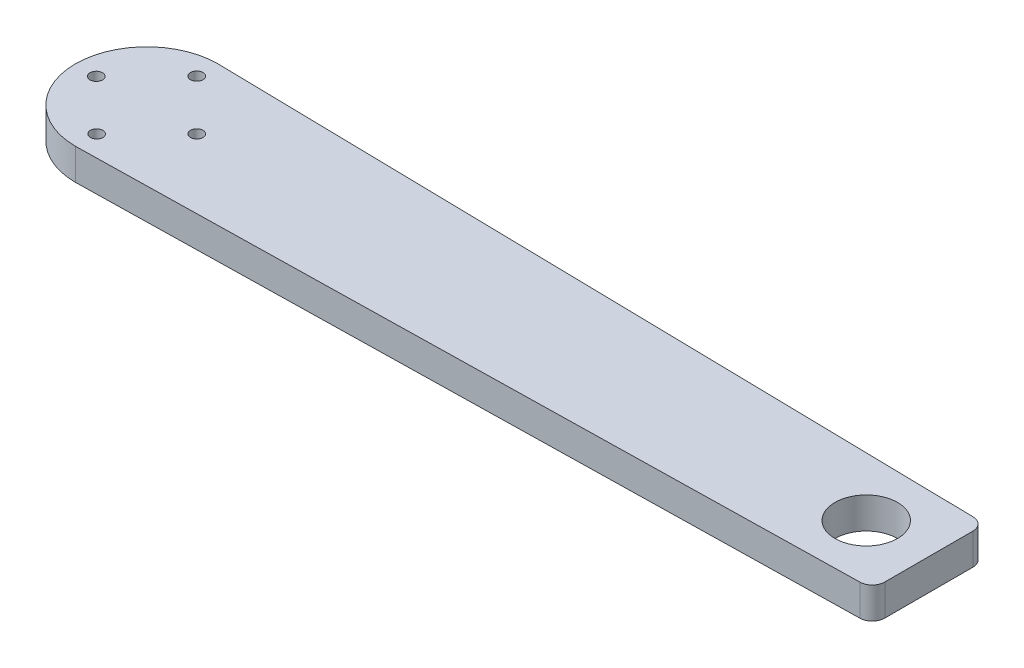
from build123d import *

# Parameters (mm, degrees)
CROQUIS1_R              = 5
CROQUIS1_R_2            = 1
SALIENTE_EXTRUIR1_DEPTH = 5
REDONDEO1_R             = 2


with BuildPart() as part:
    # Croquis1 → Saliente-Extruir1 (new body)
    with BuildSketch(Plane(origin=(0, 0, 0), x_dir=(1, 0, 0), z_dir=(0, 1, 0))):
        with BuildLine():
            Line((125, -9), (125, 9))
            Line((125, 9), (0, 11.4))
            ThreePointArc((0, 11.4), (-11.4, 0), (0, -11.4))
            Line((0, -11.4), (125, -9))
        make_face()
        with Locations(Location((115, 0, 0), (0, 0, 270))):
            Circle(CROQUIS1_R, mode=Mode.SUBTRACT)
        with Locations(Location((-8, -0.055168642, 0), (0, 0, 270))):
            Circle(CROQUIS1_R_2, mode=Mode.SUBTRACT)
        with Locations(Location((0, -8, 0), (0, 0, 270))):
            Circle(CROQUIS1_R_2, mode=Mode.SUBTRACT)
        with Locations(Location((0, 8, 0), (0, 0, 270))):
            Circle(CROQUIS1_R_2, mode=Mode.SUBTRACT)
        with Locations(Location((8, 0, 0), (0, 0, 270))):
            Circle(CROQUIS1_R_2, mode=Mode.SUBTRACT)
    extrude(amount=SALIENTE_EXTRUIR1_DEPTH)

    # Redondeo1
    redondeo1_edges = [part.edges().sort_by_distance(p)[0] for p in [
        (125, 2.5, -9),
        (125, 2.5, 9),
    ]]
    fillet(redondeo1_edges, radius=REDONDEO1_R)


solid = part.part
